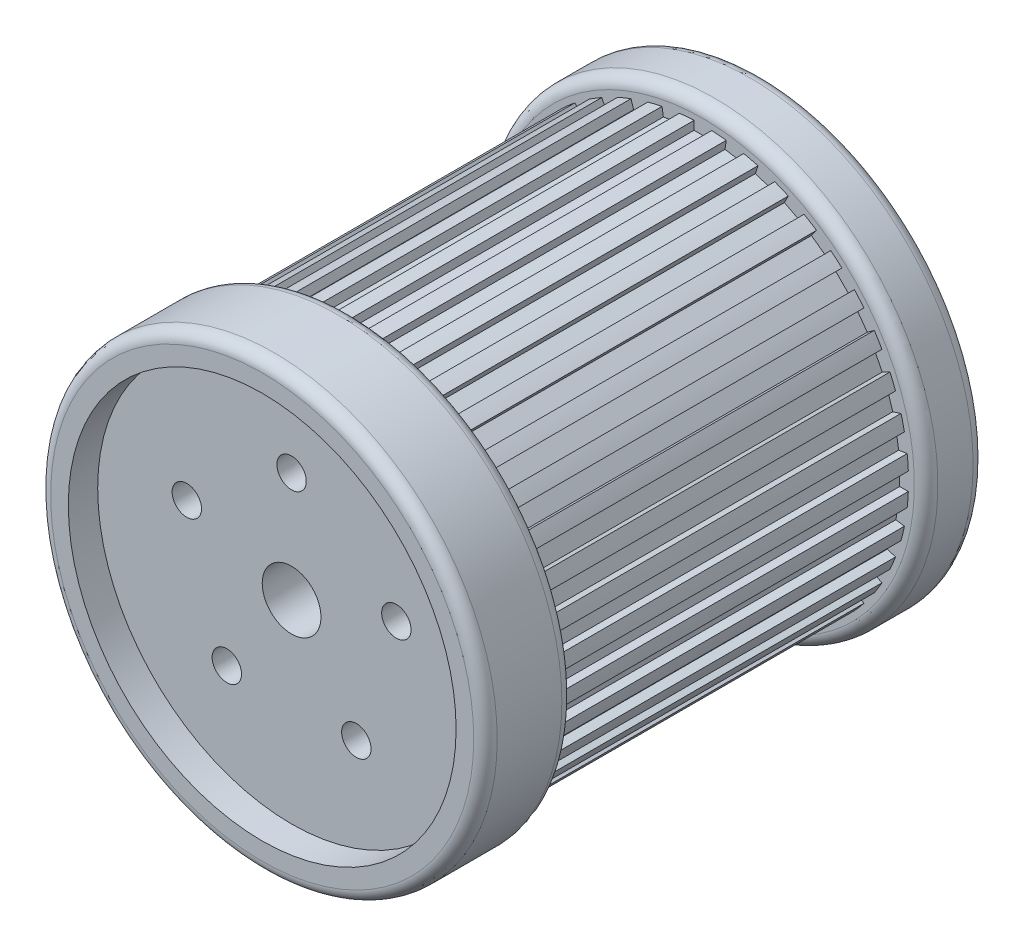
from build123d import *

# Parameters (mm, degrees)
SKETCH2_R           = 5
SKETCH2_R_2         = 2.5
CUT_EXTRUDE1_DEPTH  = 10
FILLET1_R           = 3
SKETCH3_W           = 3
SKETCH3_H           = 3
CUT_EXTRUDE2_DEPTH  = 70
SKETCH4_R           = 38
SKETCH4_R_2         = 35
BOSS_EXTRUDE2_DEPTH = 10
CIRPATTERN1_COUNT   = 40
FILLET5_R           = 2
BOSS_EXTRUDE4_START = 5
SKETCH5_R           = 38
SKETCH5_R_2         = 33
BOSS_EXTRUDE4_DEPTH = 5
BOSS_EXTRUDE5_START = -10
SKETCH6_R           = 38
SKETCH6_R_2         = 32
BOSS_EXTRUDE5_DEPTH = 10
FILLET6_R           = 2


with BuildPart() as part:
    # Sketch1 → Revolve1 (revolve)
    with BuildSketch(Plane(origin=(0, 0, 0), x_dir=(0, 0, -1), z_dir=(1, 0, 0)), mode=Mode.PRIVATE) as revolve1_sk:
        Polygon((52.5, -25), (52.5, -35), (-27.5, -35), (-27.5, 0), (-17.5, 0), (-17.5, -25), align=None)
    revolve(revolve1_sk.sketch.rotate(Axis((0, 0, 51.645581761), (0, 0, -1)), 270), axis=Axis((0, 0, 51.645581761), (0, 0, -1)))

    # Sketch2 → Cut-Extrude1 (cut)
    with BuildSketch(Plane(origin=(0, 0, 17.5), x_dir=(-1, 0, 0), z_dir=(0, 0, -1))):
        Circle(SKETCH2_R)
        with Locations((0, 18.75)):
            Circle(SKETCH2_R_2)
        with Locations((17.832309681, 5.794068645)):
            Circle(SKETCH2_R_2)
        with Locations((11.02097348, -15.169068645)):
            Circle(SKETCH2_R_2)
        with Locations((-11.02097348, -15.169068645)):
            Circle(SKETCH2_R_2)
        with Locations((-17.832309681, 5.794068645)):
            Circle(SKETCH2_R_2)
    extrude(amount=-CUT_EXTRUDE1_DEPTH, mode=Mode.SUBTRACT)

    # Fillet1
    fillet1_edges = [part.edges().sort_by_distance(p)[0] for p in [
        (-35, 0, -52.5),
        (-25, 0, -52.5),
    ]]
    fillet(fillet1_edges, radius=FILLET1_R)

    # Sketch3 → Cut-Extrude2 (cut)
    with BuildSketch(Plane(origin=(0, 0, -52.5), x_dir=(-1, 0, 0), z_dir=(0, 0, -1))):
        with Locations((0, 35)):
            Rectangle(SKETCH3_W, SKETCH3_H)
    cut_extrude2 = extrude(amount=-CUT_EXTRUDE2_DEPTH, mode=Mode.SUBTRACT)

    # Sketch4 → Boss-Extrude2 (add)
    with BuildSketch(Plane.XY.offset(27.5)):
        Circle(SKETCH4_R)
        Circle(SKETCH4_R_2, mode=Mode.SUBTRACT)
    extrude(amount=-BOSS_EXTRUDE2_DEPTH)

    # CirPattern1: Cut-Extrude2 ×40 about axis
    cirpattern1_axis = Axis((0, 0, 0), (0, 0, 1))
    for i in range(1, CIRPATTERN1_COUNT):
        add(cut_extrude2.rotate(cirpattern1_axis, i * 360 / CIRPATTERN1_COUNT), mode=Mode.SUBTRACT)

    # Fillet5
    fillet5_edges = [part.edges().sort_by_distance(p)[0] for p in [
        (-38, 0, 17.5),
    ]]
    fillet(fillet5_edges, radius=FILLET5_R)

    # Sketch5 → Boss-Extrude4 (add)
    with BuildSketch(Plane.XY.offset(27.5).offset(BOSS_EXTRUDE4_START)):
        Circle(SKETCH5_R)
        Circle(SKETCH5_R_2, mode=Mode.SUBTRACT)
    extrude(amount=-BOSS_EXTRUDE4_DEPTH)

    # Sketch6 → Boss-Extrude5 (add)
    with BuildSketch(Plane(origin=(0, 0, -52.5), x_dir=(-1, 0, 0), z_dir=(0, 0, -1)).offset(BOSS_EXTRUDE5_START)):
        with Locations(Location((0, 0, 0), (0, 0, 180))):
            Circle(SKETCH6_R)
        Circle(SKETCH6_R_2, mode=Mode.SUBTRACT)
    extrude(amount=BOSS_EXTRUDE5_DEPTH)

    # Fillet6
    fillet6_edges = [part.edges().sort_by_distance(p)[0] for p in [
        (-38, 0, -42.5),
        (-38, 0, -52.5),
        (-38, 0, 32.5),
    ]]
    fillet(fillet6_edges, radius=FILLET6_R)


solid = part.part
